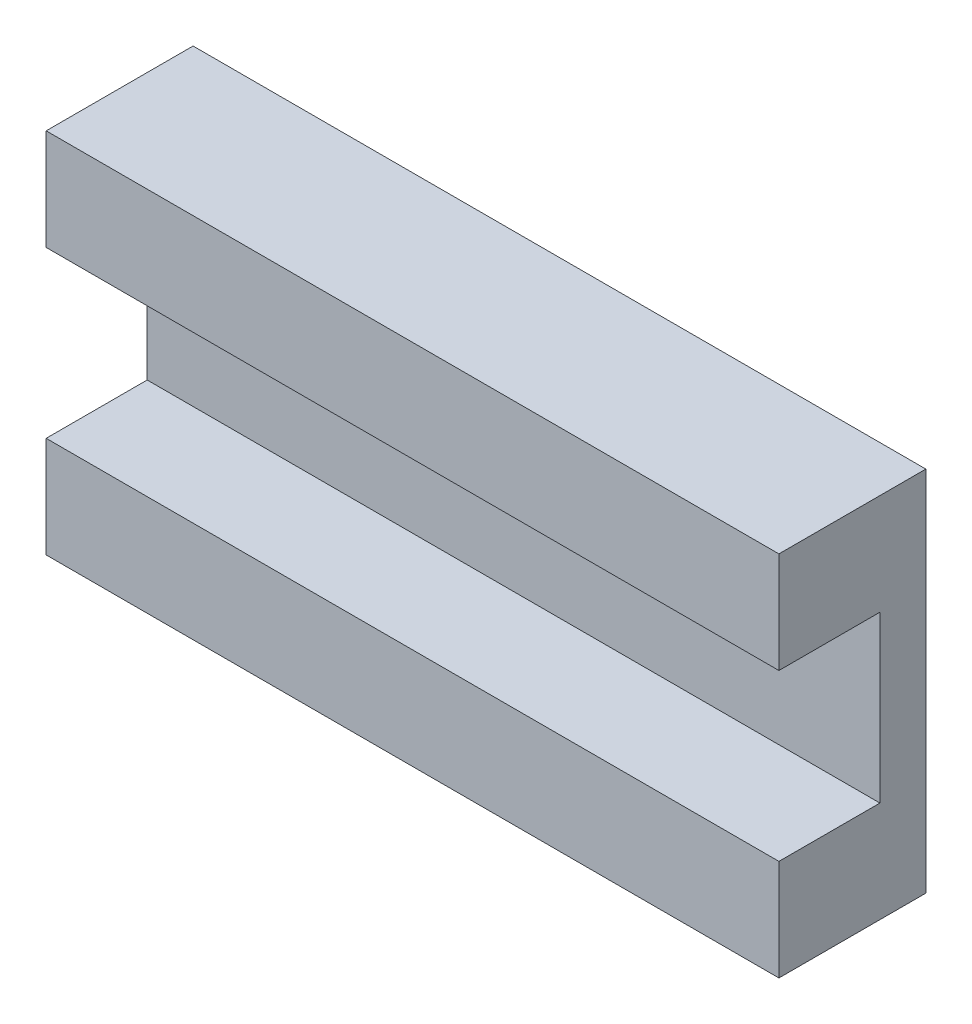
from build123d import *

# Parameters (mm, degrees)
SKETCH_1_W          = 39.9
SKETCH_1_H          = 20
EXTRUDE_1_DEPTH     = 8
SKETCH_2_R          = 1.5
CUT_EXTRUDE_1_DEPTH = 3
SKETCH_3_W          = 5.5
SKETCH_3_H          = 9
CUT_EXTRUDE_2_DEPTH = 46.343246465


with BuildPart() as part:
    # 草图1 → 凸台-拉伸1 (new body)
    with BuildSketch(Plane.XY):
        with Locations((-19.95, 10)):
            Rectangle(SKETCH_1_W, SKETCH_1_H)
    extrude(amount=EXTRUDE_1_DEPTH)

    # 草图2 → 切除-拉伸1 (cut)
    with BuildSketch(Plane(origin=(0, 0, 0), x_dir=(-1, 0, 0), z_dir=(0, 0, -1))):
        with Locations((11.95, 17.5)):
            Circle(SKETCH_2_R)
        with Locations((27.95, 17.5)):
            Circle(SKETCH_2_R)
        with Locations(Location((27.95, 2.5, 0), (0, 0, 180))):
            Circle(SKETCH_2_R)
        with Locations(Location((11.95, 2.5, 0), (0, 0, 180))):
            Circle(SKETCH_2_R)
    extrude(amount=-CUT_EXTRUDE_1_DEPTH, mode=Mode.SUBTRACT)

    # 草图3 → 切除-拉伸2 (cut, through all)
    with BuildSketch(Plane(origin=(0, 0, 0), x_dir=(0, 0, -1), z_dir=(1, 0, 0))):
        with Locations((-5.25, 10)):
            Rectangle(SKETCH_3_W, SKETCH_3_H)
    extrude(amount=-CUT_EXTRUDE_2_DEPTH, mode=Mode.SUBTRACT)


solid = part.part
